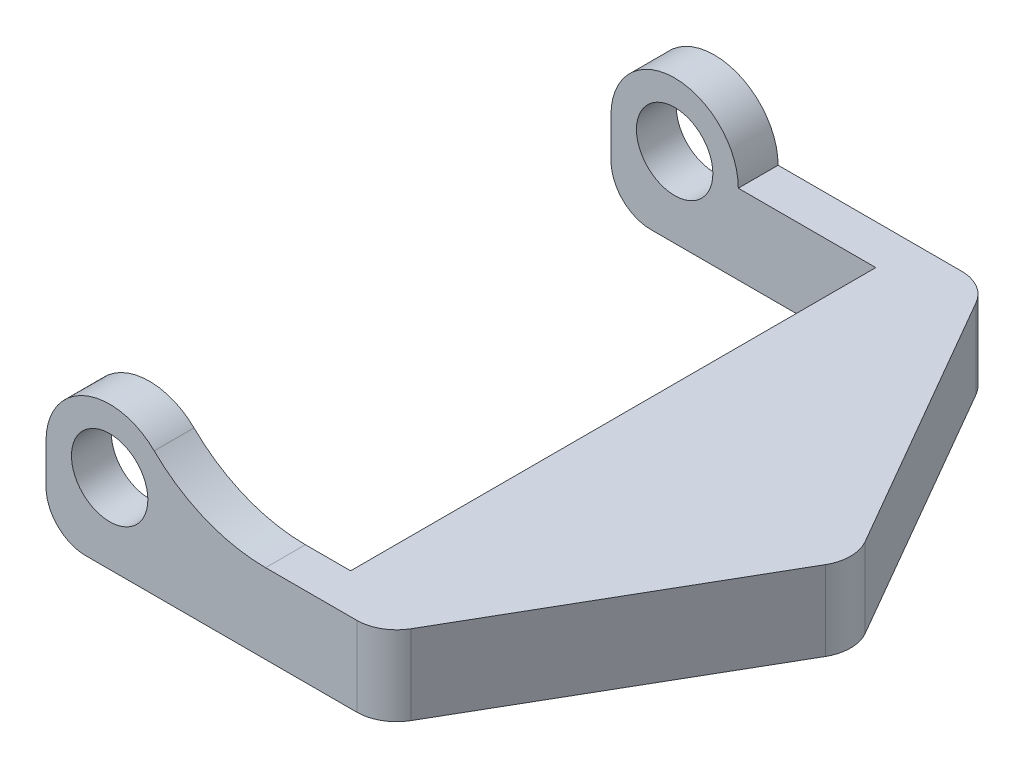
from build123d import *

# Parameters (mm, degrees)
BOSS_EXTRUDE1_DEPTH  = 5
BOSS_EXTRUDE2_DEPTH  = 2.5
M4_CLEARANCE_HOLE2_D = 4.8
FILLET1_R            = 10
FILLET2_R            = 2.5


with BuildPart() as part:
    # Sketch1 → Boss-Extrude1 (new body)
    with BuildSketch(Plane(origin=(0, 0, 0), x_dir=(1, 0, 0), z_dir=(0, 1, 0))):
        Polygon((10.969655115, 19), (21.939310229, 0), (10.969655115, -19), (0, -19), (-10, -19), (-10, -16.5), (6.639528096, -16.5), (6.639528096, 16.5), (-10, 16.5), (-10, 19), (0, 19), align=None)
    extrude(amount=BOSS_EXTRUDE1_DEPTH)

    # Sketch2 → Boss-Extrude2 (add)
    with BuildSketch(Plane.XY.offset(19)):
        with BuildLine():
            Line((-10, 5), (-2, 5))
            ThreePointArc((-2, 5), (-6, 9), (-10, 5))
        make_face()
    boss_extrude2 = extrude(amount=-BOSS_EXTRUDE2_DEPTH)

    # Mirror1: Boss-Extrude2 across plane
    add(boss_extrude2.mirror(Plane.XY))

    # M4 Clearance Hole2 (through all)
    with Locations(Plane(origin=(-6, 5, 19), x_dir=(1, 0, 0), z_dir=(0, 0, 1))):
        with Locations((0, 0)):
            Hole(M4_CLEARANCE_HOLE2_D / 2)

    # Fillet1
    fillet1_edges = [part.edges().sort_by_distance(p)[0] for p in [
        (-2, 5, 17.75),
    ]]
    fillet(fillet1_edges, radius=FILLET1_R)

    # Fillet2
    fillet2_edges = [part.edges().sort_by_distance(p)[0] for p in [
        (-10, 0, 17.75),
        (-10, 0, -17.75),
        (10.969655115, 2.5, -19),
        (21.939310229, 2.5, 0),
        (10.969655115, 2.5, 19),
    ]]
    fillet(fillet2_edges, radius=FILLET2_R)


solid = part.part
